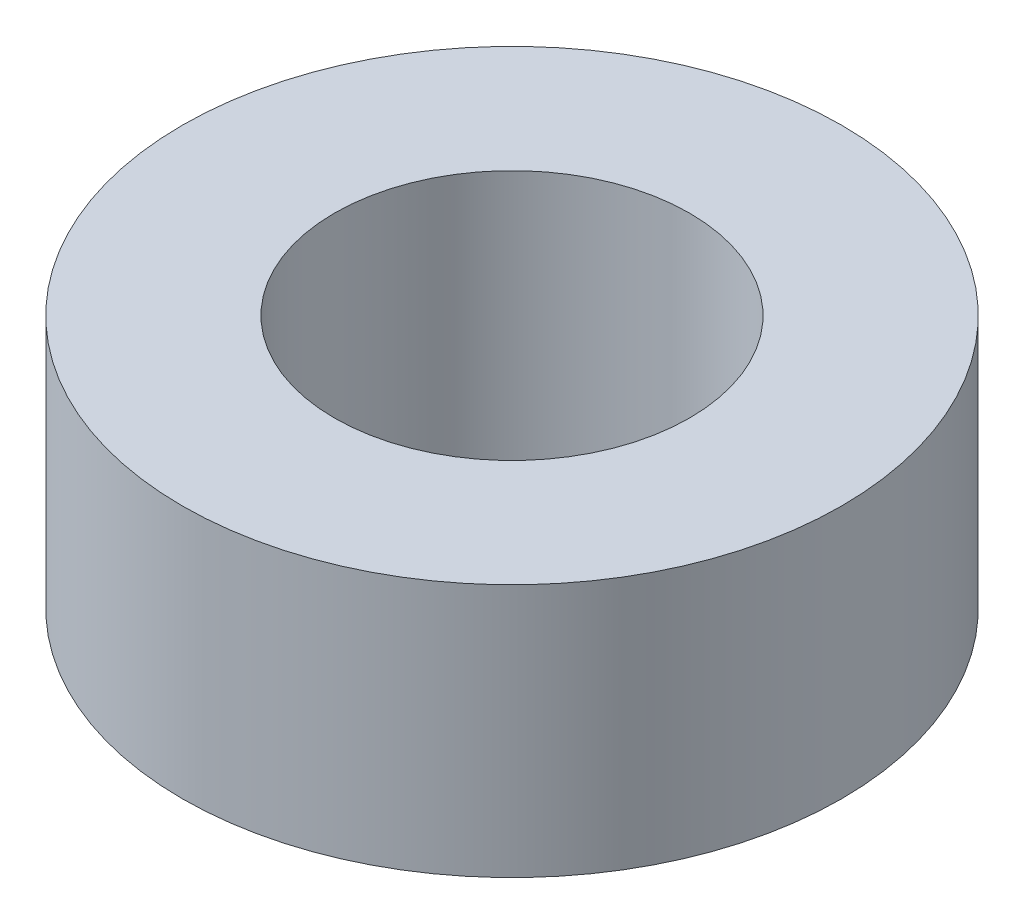
from build123d import *

# Parameters (mm, degrees)
SKETCH1_R           = 6.5
SKETCH1_R_2         = 3.5
BOSS_EXTRUDE1_DEPTH = 5
SKETCH2_R           = 0.5


with BuildPart() as part:
    # Sketch1 → Boss-Extrude1 (new body)
    with BuildSketch(Plane(origin=(0, 0, 0), x_dir=(1, 0, 0), z_dir=(0, 1, 0))):
        with Locations(Location((0, 0, 0), (0, 0, 270))):
            Circle(SKETCH1_R)
        with Locations(Location((0, 0, 0), (0, 0, 270))):
            Circle(SKETCH1_R_2, mode=Mode.SUBTRACT)
    extrude(amount=BOSS_EXTRUDE1_DEPTH)

    # Sketch2 → Cut-Revolve1 (revolve, cut)
    with BuildSketch(Plane(origin=(0, 0, 0), x_dir=(0, 0, -1), z_dir=(1, 0, 0))):
        with Locations((-5, 4)):
            Circle(SKETCH2_R)
        with Locations((-5, 2.5)):
            Circle(SKETCH2_R)
        with Locations((-5, 1)):
            Circle(SKETCH2_R)
    revolve(axis=Axis((0, 5.605308193, 0), (0, -1, 0)), mode=Mode.SUBTRACT)


solid = part.part
